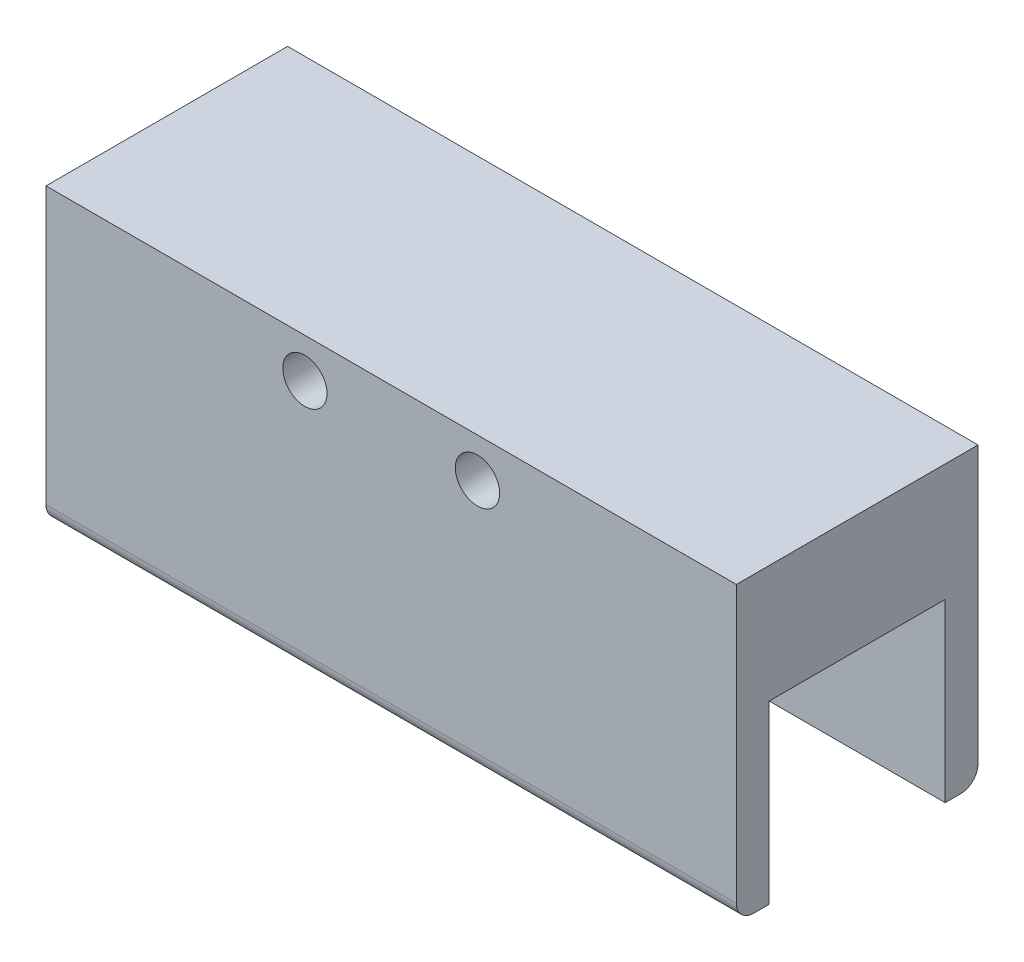
from build123d import *

# Parameters (mm, degrees)
SKETCH2_W           = 200
SKETCH2_H           = 85
BOSS_EXTRUDE1_DEPTH = 70
SKETCH3_W           = 51
SKETCH3_H           = 51
CUT_EXTRUDE1_DEPTH  = 229.309001137
FILLET1_R           = 5
SKETCH4_R           = 6.415
CUT_EXTRUDE2_DEPTH  = 229.309001137


with BuildPart() as part:
    # Sketch2 → Boss-Extrude1 (new body)
    with BuildSketch(Plane.XY):
        with Locations((100, 42.5)):
            Rectangle(SKETCH2_W, SKETCH2_H)
    extrude(amount=BOSS_EXTRUDE1_DEPTH)

    # Sketch3 → Cut-Extrude1 (cut, through all)
    with BuildSketch(Plane(origin=(200, 0, 0), x_dir=(0, 0, -1), z_dir=(1, 0, 0))):
        with Locations((-35, 25.5)):
            Rectangle(SKETCH3_W, SKETCH3_H)
    extrude(amount=-CUT_EXTRUDE1_DEPTH, mode=Mode.SUBTRACT)

    # Fillet1
    fillet1_edges = [part.edges().sort_by_distance(p)[0] for p in [
        (100, 0, 0),
        (100, 0, 70),
    ]]
    fillet(fillet1_edges, radius=FILLET1_R)

    # Sketch4 → Cut-Extrude2 (cut, through all)
    with BuildSketch(Plane.XY.offset(70)):
        with Locations((125, 73.585)):
            Circle(SKETCH4_R)
        with Locations(Location((75, 73.585, 0), (0, 0, 180))):
            Circle(SKETCH4_R)
    extrude(amount=-CUT_EXTRUDE2_DEPTH, mode=Mode.SUBTRACT)


solid = part.part
